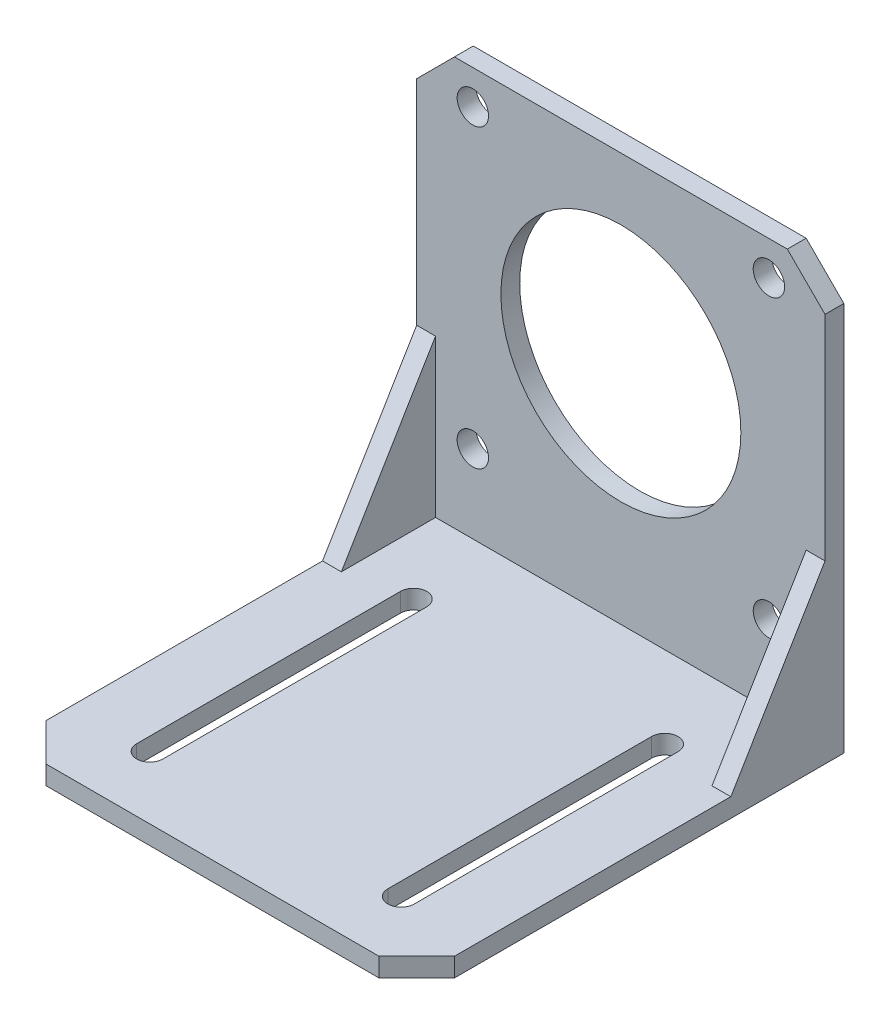
from build123d import *

# Parameters (mm, degrees)
BOSS_EXTRUDE1_DEPTH = 3
SKETCH2_W           = 65
SKETCH2_H           = 3
BOSS_EXTRUDE2_DEPTH = 65
CUT_EXTRUDE1_REACH  = 114.663
SKETCH3_R           = 2.5
SKETCH3_R_2         = 19.1
SKETCH4_R           = 19.1
SKETCH4_R_2         = 2.5
BOSS_EXTRUDE3_DEPTH = 3
SKETCH5_W           = 65
SKETCH5_H           = 66.483873972
CUT_EXTRUDE2_DEPTH  = 3
SKETCH6_R           = 2.5
CUT_EXTRUDE3_DEPTH  = 3
BOSS_EXTRUDE5_DEPTH = 3
BOSS_EXTRUDE6_DEPTH = 3


with BuildPart() as part:
    # Sketch1 → Boss-Extrude1 (new body)
    with BuildSketch(Plane(origin=(0, 0, 0), x_dir=(1, 0, 0), z_dir=(0, 1, 0))):
        Polygon((52.5, 0), (59, 0), (65, 6), (65, 65), (0, 65), (0, 6), (6, 0), align=None)
        with BuildLine():
            ThreePointArc((54.6, 10), (53.98492424, 8.51507576), (52.5, 7.9))
            ThreePointArc((52.5, 7.9), (51.01507576, 8.51507576), (50.4, 10))
            Line((50.4, 10), (50.4, 52))
            ThreePointArc((50.4, 52), (52.5, 54.1), (54.6, 52))
            Line((54.6, 52), (54.6, 10))
        make_face(mode=Mode.SUBTRACT)
        with BuildLine():
            Line((14.6, 52), (14.624057294, 52))
            Line((14.624057294, 52), (14.6, 10))
            ThreePointArc((14.6, 10), (12.5, 7.9), (10.4, 10))
            Line((10.4, 10), (10.4, 52))
            ThreePointArc((10.4, 52), (12.5, 54.1), (14.6, 52))
        make_face(mode=Mode.SUBTRACT)
    extrude(amount=BOSS_EXTRUDE1_DEPTH)

    # Sketch2 → Boss-Extrude2 (add)
    with BuildSketch(Plane(origin=(0, 3, 0), x_dir=(1, 0, 0), z_dir=(0, 1, 0))):
        with Locations((32.5, 63.5)):
            Rectangle(SKETCH2_W, SKETCH2_H)
    extrude(amount=BOSS_EXTRUDE2_DEPTH)

    # Sketch3 → Cut-Extrude1 (cut, up to next)
    with BuildSketch(Plane.XY.offset(-62), mode=Mode.PRIVATE) as cut_extrude1_sk1:
        Polygon((6, 68), (0, 68), (0, 62), align=None)
    cut_extrude1_tool1 = extrude(cut_extrude1_sk1.sketch, amount=-CUT_EXTRUDE1_REACH, mode=Mode.PRIVATE) & part.part
    # Sketch3 → Cut-Extrude1 (cut, up to next)
    with BuildSketch(Plane.XY.offset(-62), mode=Mode.PRIVATE) as cut_extrude1_sk2:
        with Locations((8.93, 15.43)):
            Circle(SKETCH3_R)
    cut_extrude1_tool2 = extrude(cut_extrude1_sk2.sketch, amount=-CUT_EXTRUDE1_REACH, mode=Mode.PRIVATE) & part.part
    # Sketch3 → Cut-Extrude1 (cut, up to next)
    with BuildSketch(Plane.XY.offset(-62), mode=Mode.PRIVATE) as cut_extrude1_sk3:
        with Locations((56.07, 15.43)):
            Circle(SKETCH3_R)
    cut_extrude1_tool3 = extrude(cut_extrude1_sk3.sketch, amount=-CUT_EXTRUDE1_REACH, mode=Mode.PRIVATE) & part.part
    # Sketch3 → Cut-Extrude1 (cut, up to next)
    with BuildSketch(Plane.XY.offset(-62), mode=Mode.PRIVATE) as cut_extrude1_sk4:
        with Locations((56.07, 62.57)):
            Circle(SKETCH3_R)
    cut_extrude1_tool4 = extrude(cut_extrude1_sk4.sketch, amount=-CUT_EXTRUDE1_REACH, mode=Mode.PRIVATE) & part.part
    # Sketch3 → Cut-Extrude1 (cut, up to next)
    with BuildSketch(Plane.XY.offset(-62), mode=Mode.PRIVATE) as cut_extrude1_sk5:
        with Locations((32.5, 39)):
            Circle(SKETCH3_R_2)
    cut_extrude1_tool5 = extrude(cut_extrude1_sk5.sketch, amount=-CUT_EXTRUDE1_REACH, mode=Mode.PRIVATE) & part.part
    # Sketch3 → Cut-Extrude1 (cut, up to next)
    with BuildSketch(Plane.XY.offset(-62), mode=Mode.PRIVATE) as cut_extrude1_sk6:
        Polygon((65, 68), (59, 68), (65, 62), align=None)
    cut_extrude1_tool6 = extrude(cut_extrude1_sk6.sketch, amount=-CUT_EXTRUDE1_REACH, mode=Mode.PRIVATE) & part.part
    # Sketch3 → Cut-Extrude1 (cut, up to next)
    with BuildSketch(Plane.XY.offset(-62), mode=Mode.PRIVATE) as cut_extrude1_sk7:
        with BuildLine():
            ThreePointArc((11.43, 62.57), (7.214795913, 64.388811408), (8.783540049, 60.074293791))
            ThreePointArc((8.783540049, 60.074293791), (10.645204087, 60.751188592), (11.43, 62.57))
        make_face()
    cut_extrude1_tool7 = extrude(cut_extrude1_sk7.sketch, amount=-CUT_EXTRUDE1_REACH, mode=Mode.PRIVATE) & part.part
    add(cut_extrude1_tool1.solids().sort_by_distance((2, 66, -62))[0], mode=Mode.SUBTRACT)
    add(cut_extrude1_tool2.solids().sort_by_distance((8.93, 15.43, -62))[0], mode=Mode.SUBTRACT)
    add(cut_extrude1_tool3.solids().sort_by_distance((56.07, 15.43, -62))[0], mode=Mode.SUBTRACT)
    add(cut_extrude1_tool4.solids().sort_by_distance((56.07, 62.57, -62))[0], mode=Mode.SUBTRACT)
    add(cut_extrude1_tool5.solids().sort_by_distance((32.5, 39, -62))[0], mode=Mode.SUBTRACT)
    add(cut_extrude1_tool6.solids().sort_by_distance((63, 66, -62))[0], mode=Mode.SUBTRACT)
    add(cut_extrude1_tool7.solids().sort_by_distance((8.93, 62.57, -62))[0], mode=Mode.SUBTRACT)

    # Sketch4 → Boss-Extrude3 (add)
    with BuildSketch(Plane(origin=(0, 0, -65), x_dir=(-1, 0, 0), z_dir=(0, 0, -1))):
        Polygon((-65, 62), (-59, 68), (-6, 68), (0, 62), (0, 0), (-65, 0), align=None)
        with Locations(Location((-32.5, 39, 0), (0, 0, 180))):
            Circle(SKETCH4_R, mode=Mode.SUBTRACT)
        with Locations(Location((-56.07, 62.57, 0), (0, 0, 180))):
            Circle(SKETCH4_R_2, mode=Mode.SUBTRACT)
        with Locations(Location((-8.93, 62.57, 0), (0, 0, 180))):
            Circle(SKETCH4_R_2, mode=Mode.SUBTRACT)
    extrude(amount=BOSS_EXTRUDE3_DEPTH)

    # Sketch5 → Cut-Extrude2 (cut)
    with BuildSketch(Plane.XY.offset(-62)):
        with Locations((32.5, 36.241936986)):
            Rectangle(SKETCH5_W, SKETCH5_H)
    extrude(amount=-CUT_EXTRUDE2_DEPTH, mode=Mode.SUBTRACT)

    # Sketch6 → Cut-Extrude3 (cut)
    with BuildSketch(Plane(origin=(0, 0, -68), x_dir=(-1, 0, 0), z_dir=(0, 0, -1))):
        with Locations((-56.07, 15.43)):
            Circle(SKETCH6_R)
        with Locations((-8.93, 15.43)):
            Circle(SKETCH6_R)
    extrude(amount=-CUT_EXTRUDE3_DEPTH, mode=Mode.SUBTRACT)

    # Sketch7 → Boss-Extrude5 (add)
    with BuildSketch(Plane.ZY):
        Polygon((-65, 3), (-50, 3), (-65, 28), align=None)
    extrude(amount=-BOSS_EXTRUDE5_DEPTH)

    # Sketch8 → Boss-Extrude6 (add)
    with BuildSketch(Plane(origin=(65, 0, 0), x_dir=(0, 0, -1), z_dir=(1, 0, 0))):
        Polygon((65, 3), (50, 3), (65, 28), align=None)
    extrude(amount=-BOSS_EXTRUDE6_DEPTH)


solid = part.part
